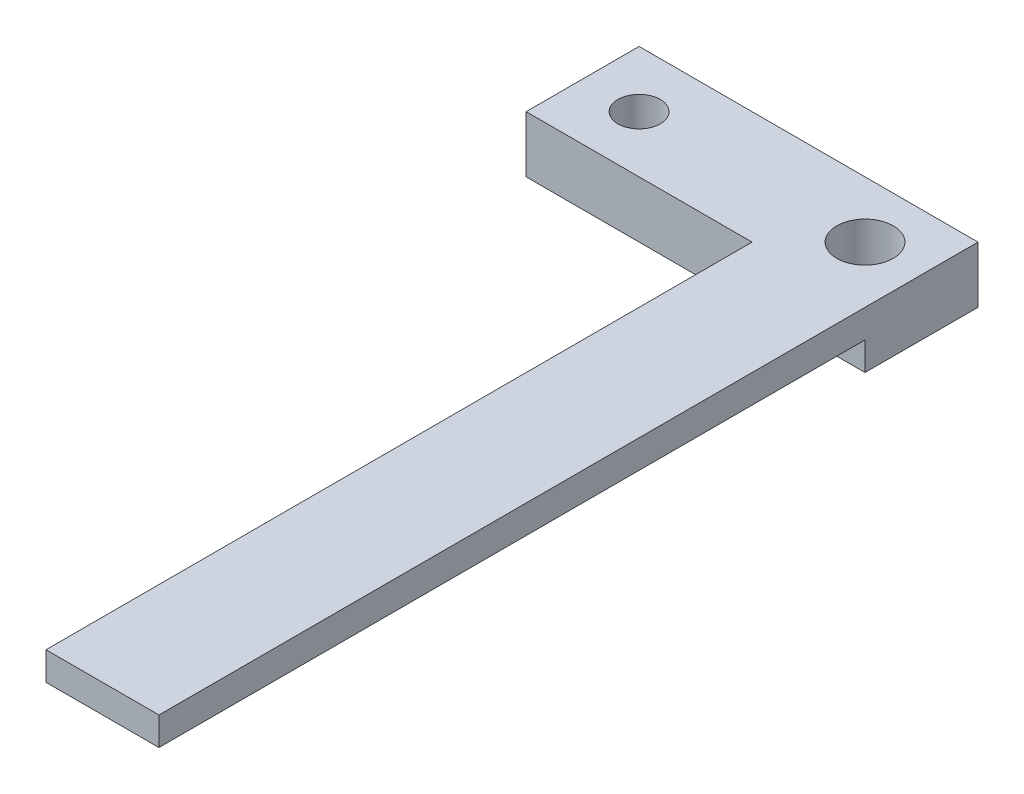
from build123d import *
from build123d.topology import SkipClean

# Parameters (mm, degrees)
SKETCH1_W           = 120
SKETCH1_H           = 40
SKETCH1_R           = 7.5
SKETCH1_R_2         = 10
BOSS_EXTRUDE1_DEPTH = 20
BOSS_EXTRUDE2_START = 10
SKETCH2_R           = 10
SKETCH2_R_2         = 7.5
BOSS_EXTRUDE2_DEPTH = 10
SKETCH3_W           = 40
SKETCH3_H           = 10
BOSS_EXTRUDE3_DEPTH = 250


with BuildPart() as part:
    # Sketch1 → Boss-Extrude1 (new body)
    with BuildSketch(Plane(origin=(0, 0, 0), x_dir=(1, 0, 0), z_dir=(0, 1, 0))):
        Rectangle(SKETCH1_W, SKETCH1_H)
        with Locations(Location((-40, 0, 0), (0, 0, 270))):
            Circle(SKETCH1_R, mode=Mode.SUBTRACT)
        with Locations(Location((40, 0, 0), (0, 0, 270))):
            Circle(SKETCH1_R_2, mode=Mode.SUBTRACT)
    extrude(amount=BOSS_EXTRUDE1_DEPTH)

    # Sketch2 → Boss-Extrude2 (add)
    with SkipClean():  # the faces are left unmerged after this step: merging them gives an invalid solid
        with BuildSketch(Plane.XZ.offset(BOSS_EXTRUDE2_START)):
            with Locations(Location((-40, 0, 0), (0, 0, 270))):
                Circle(SKETCH2_R)
            with Locations(Location((-40, 0, 0), (0, 0, 270))):
                Circle(SKETCH2_R_2, mode=Mode.SUBTRACT)
        extrude(amount=-BOSS_EXTRUDE2_DEPTH)

    # Sketch3 → Boss-Extrude3 (add)
    with SkipClean():  # the faces are left unmerged after this step: merging them gives an invalid solid
        with BuildSketch(Plane.XY.offset(20)):
            with Locations((40, 15)):
                Rectangle(SKETCH3_W, SKETCH3_H)
        extrude(amount=BOSS_EXTRUDE3_DEPTH)


solid = part.part
